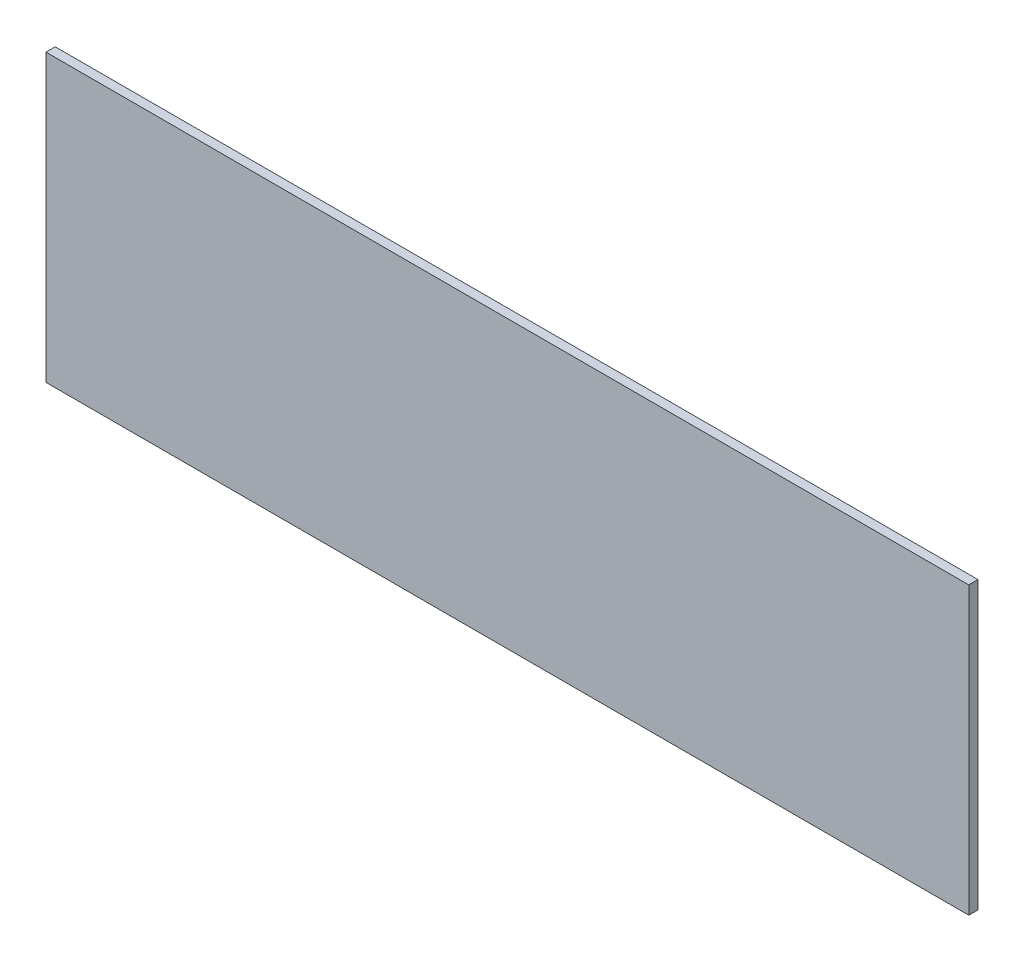
from build123d import *

# Parameters (mm, degrees)
BOSS_EXTRUDE1_DEPTH = 3


with BuildPart() as part:
    # Sketch1 → Boss-Extrude1 (new body)
    with BuildSketch(Plane.XY):
        Polygon((-122, 0), (-122, -3), (-122, -93), (178, -93), (178, -3), (178, 0), align=None)
    extrude(amount=BOSS_EXTRUDE1_DEPTH)


solid = part.part
